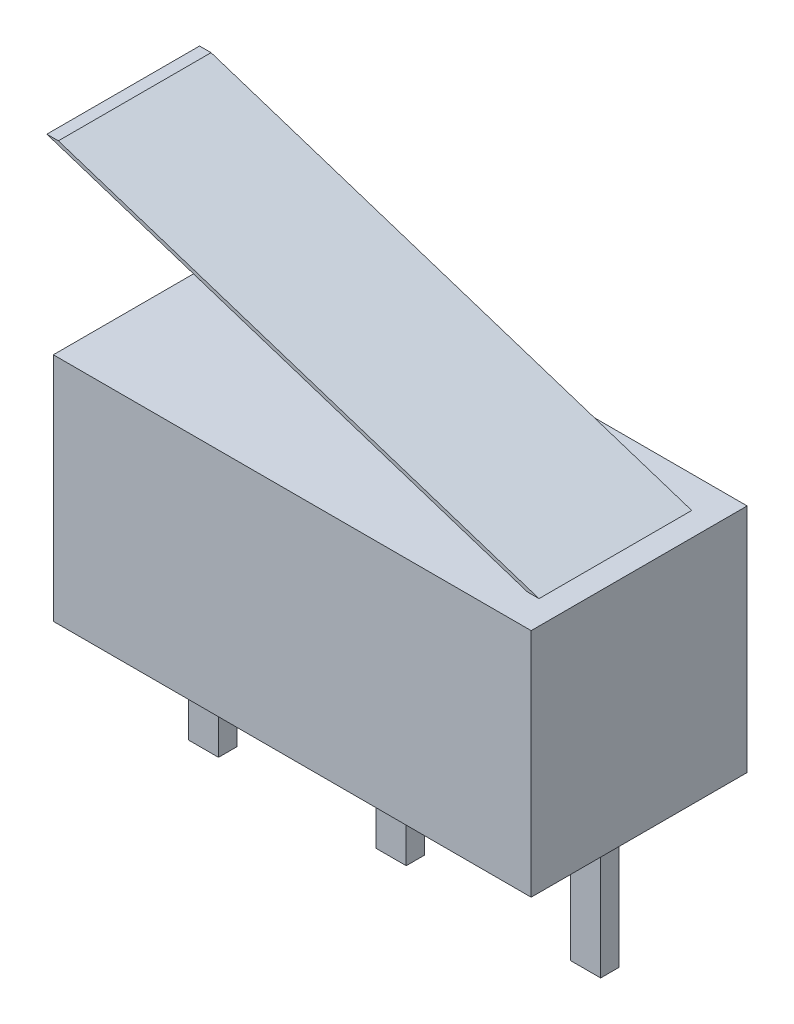
from build123d import *

# Parameters (mm, degrees)
SKETCH1_W           = 12.83
SKETCH1_H           = 5.8
BOSS_EXTRUDE1_DEPTH = 6.2
SKETCH2_W           = 0.31
SKETCH2_H           = 4.1
SKETCH4_W           = 0.81
SKETCH4_H           = 0.49
BOSS_EXTRUDE2_DEPTH = 3.6


with BuildPart() as part:
    # Sketch1 → Boss-Extrude1 (new body)
    with BuildSketch(Plane(origin=(0, 0, 0), x_dir=(1, 0, 0), z_dir=(0, 1, 0))):
        Rectangle(SKETCH1_W, SKETCH1_H)
    extrude(amount=BOSS_EXTRUDE1_DEPTH)

    # Sweep1: sweep along a path in Sketch3
    with BuildLine(Plane.XY.offset(2.9)) as sweep1_path:
        Line((5.621209299, 6.2), (-7.284880173, 10.392583278))
    # Sketch2 → Sweep1 (sweep)
    with BuildSketch(Plane(origin=(0, 6.2, 0), x_dir=(1, 0, 0), z_dir=(0, 1, 0))):
        with Locations((5.621209299, 0)):
            Rectangle(SKETCH2_W, SKETCH2_H)
    sweep(path=sweep1_path.line)

    # Sketch4 → Boss-Extrude2 (add)
    with BuildSketch(Plane.XZ):
        with Locations((-5.04, 0)):
            Rectangle(SKETCH4_W, SKETCH4_H)
        Rectangle(SKETCH4_W, SKETCH4_H)
        with Locations((5.220937528, 0)):
            Rectangle(SKETCH4_W, SKETCH4_H)
    extrude(amount=BOSS_EXTRUDE2_DEPTH)


solid = part.part
